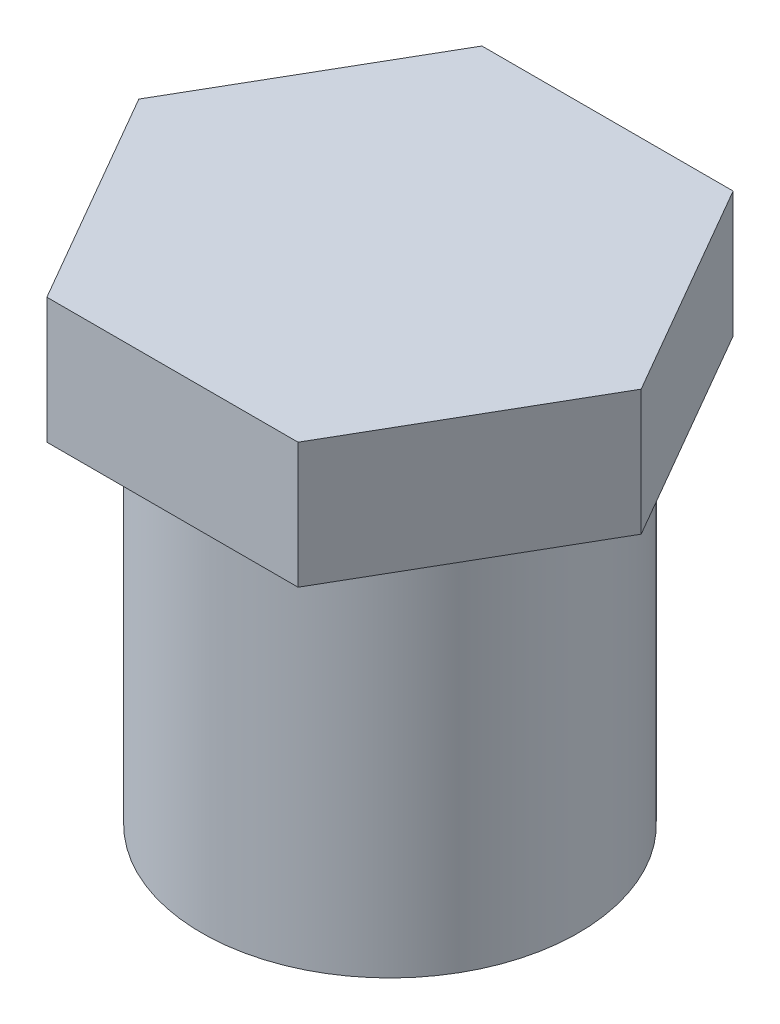
from build123d import *

# Parameters (mm, degrees)
SKETCH1_R           = 1.905
BOSS_EXTRUDE1_DEPTH = 3.81
BOSS_EXTRUDE2_DEPTH = 1.27


with BuildPart() as part:
    # Sketch1 → Boss-Extrude1 (new body)
    with BuildSketch(Plane(origin=(0, 0, 0), x_dir=(1, 0, 0), z_dir=(0, 1, 0))):
        with Locations(Location((0, 0, 0), (0, 0, 90))):
            Circle(SKETCH1_R)
    extrude(amount=BOSS_EXTRUDE1_DEPTH)

    # Sketch2 → Boss-Extrude2 (add)
    with BuildSketch(Plane(origin=(0, 3.81, 0), x_dir=(1, 0, 0), z_dir=(0, 1, 0))):
        Polygon((1.27, 2.199704526), (-1.27, 2.199704526), (-2.54, 0), (-1.27, -2.199704526), (1.27, -2.199704526), (2.54, 0), align=None)
    extrude(amount=BOSS_EXTRUDE2_DEPTH)


solid = part.part
